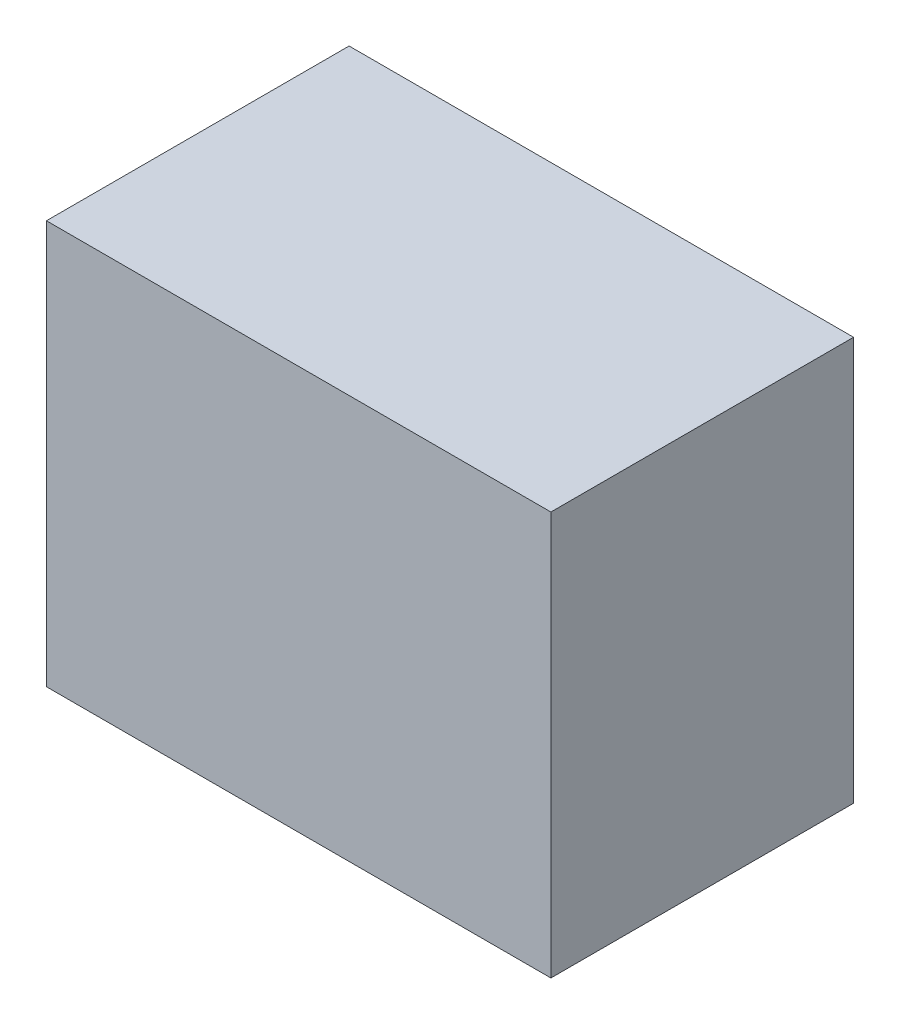
from build123d import *

# Parameters (mm, degrees)
SKETCH1_W           = 50
SKETCH1_H           = 40
BOSS_EXTRUDE1_DEPTH = 30


with BuildPart() as part:
    # Sketch1 → Boss-Extrude1 (new body)
    with BuildSketch(Plane.XY):
        with Locations((20.620297899, -16.97368531)):
            Rectangle(SKETCH1_W, SKETCH1_H)
    extrude(amount=BOSS_EXTRUDE1_DEPTH)


solid = part.part
